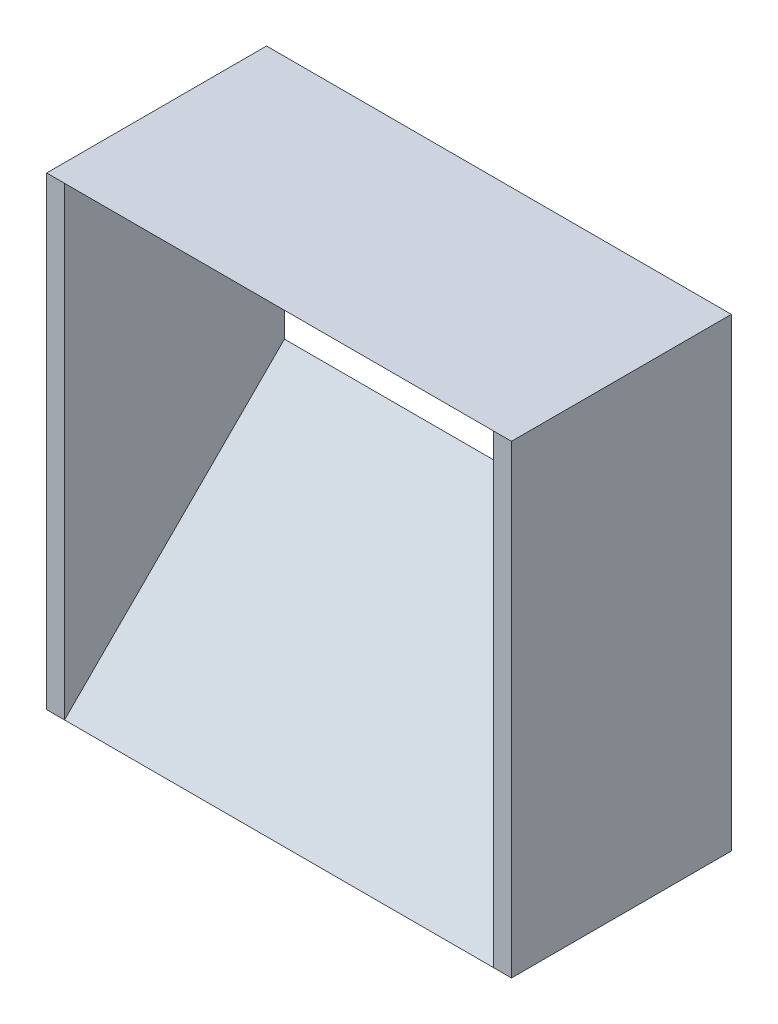
from build123d import *

# Parameters (mm, degrees)
BOSS_EXTRUDE1_DEPTH        = 60
BOSS_EXTRUDE1_DEPTH_BACK   = 60
BOSS_EXTRUDE1_2_DEPTH      = 60
BOSS_EXTRUDE1_2_DEPTH_BACK = 60
SKETCH2_W                  = 130
SKETCH2_H                  = 61.5
BOSS_EXTRUDE2_DEPTH        = 5


with BuildPart() as part:
    # Sketch1 → Boss-Extrude1 (new, two sides: drawn at the far end of the back side and taken through both)
    with BuildSketch(Plane.YZ.offset(-BOSS_EXTRUDE1_DEPTH_BACK)):
        Polygon((3.5, 0), (65, 61.5), (65, 0), (59, 0), (59, 49.5), (9.5, 0), align=None)
    extrude(amount=BOSS_EXTRUDE1_DEPTH + BOSS_EXTRUDE1_DEPTH_BACK)



with BuildPart() as body_2:
    # Sketch1 → Boss-Extrude1 2 (new, two sides: drawn at the far end of the back side and taken through both)
    with BuildSketch(Plane.YZ.offset(-BOSS_EXTRUDE1_2_DEPTH_BACK)):
        Polygon((-65, 61.5), (-3.5, 0), (-9.5, 0), (-59, 49.5), (-59, 0), (-65, 0), align=None)
    extrude(amount=BOSS_EXTRUDE1_2_DEPTH + BOSS_EXTRUDE1_2_DEPTH_BACK)


with BuildPart() as part_1:
    add(part.part)

    add(body_2.part)  # Boss-Extrude2 merges body 2
    # Sketch2 → Boss-Extrude2 (add)
    with BuildSketch(Plane.YZ.offset(60)):
        with Locations((0, 30.75)):
            Rectangle(SKETCH2_W, SKETCH2_H)
    boss_extrude2 = extrude(amount=BOSS_EXTRUDE2_DEPTH)

    # Mirror1: Boss-Extrude2 across plane
    add(boss_extrude2.mirror(Plane(origin=(0, 0, 0), x_dir=(0, 0, 1), z_dir=(1, 0, 0))))


solid = part_1.part
